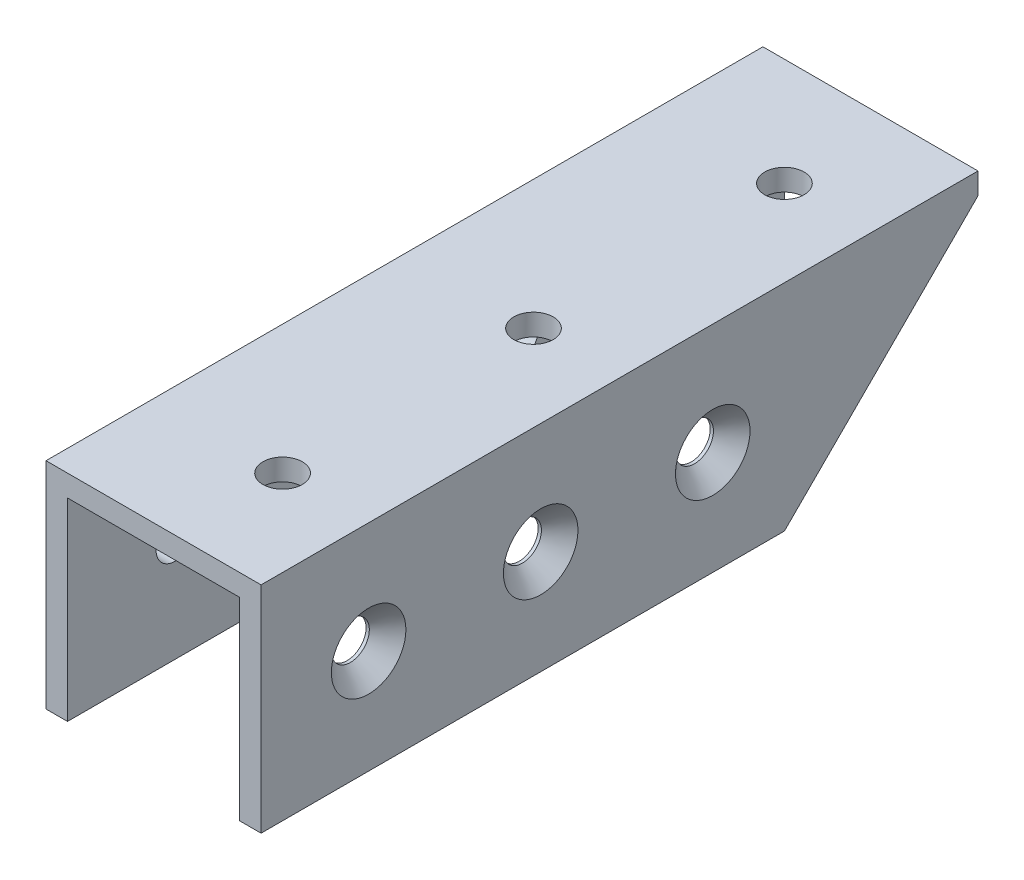
from build123d import *

# Parameters (mm, degrees)
DODANIE_WYCI_GNI_CIE1_DEPTH                         = 100
M5_CLEARANCE_HOLE1_D                                = 5.5
CSK_FOR_M5_COUNTERSUNK_FLAT_HEAD_SCREW1_D           = 5.3
CSK_FOR_M5_COUNTERSUNK_FLAT_HEAD_SCREW1_CSINK_D     = 10.4
CSK_FOR_M5_COUNTERSUNK_FLAT_HEAD_SCREW1_CSINK_ANGLE = 90
CHAMFER1_SIZE                                       = 27


with BuildPart() as part:
    # Szkic1 → Dodanie-wyciągnięcie1 (new body)
    with BuildSketch(Plane.XY):
        Polygon((0, 0), (0, 30), (30, 30), (30, 0), (27, 0), (27, 27), (3, 27), (3, 0), align=None)
    extrude(amount=DODANIE_WYCI_GNI_CIE1_DEPTH)

    # M5 Clearance Hole1 (through all)
    with Locations(Plane(origin=(0, 30, 0), x_dir=(1, 0, 0), z_dir=(0, 1, 0))):
        with Locations((18, -50), (18, -15), (18, -85)):
            Hole(M5_CLEARANCE_HOLE1_D / 2)

    # CSK for M5 Countersunk Flat Head Screw1 (through all)
    with Locations(Plane(origin=(30, 0, 0), x_dir=(0, 0, -1), z_dir=(1, 0, 0))):
        with Locations((-37, 14.5), (-85, 14.5), (-61, 14.5)):
            CounterSinkHole(CSK_FOR_M5_COUNTERSUNK_FLAT_HEAD_SCREW1_D / 2, CSK_FOR_M5_COUNTERSUNK_FLAT_HEAD_SCREW1_CSINK_D / 2, counter_sink_angle=CSK_FOR_M5_COUNTERSUNK_FLAT_HEAD_SCREW1_CSINK_ANGLE)

    # Chamfer1
    chamfer1_edges = [part.edges().sort_by_distance(p)[0] for p in [
        (28.5, 0, 0),
    ]]
    chamfer(chamfer1_edges, length=CHAMFER1_SIZE)


solid = part.part
